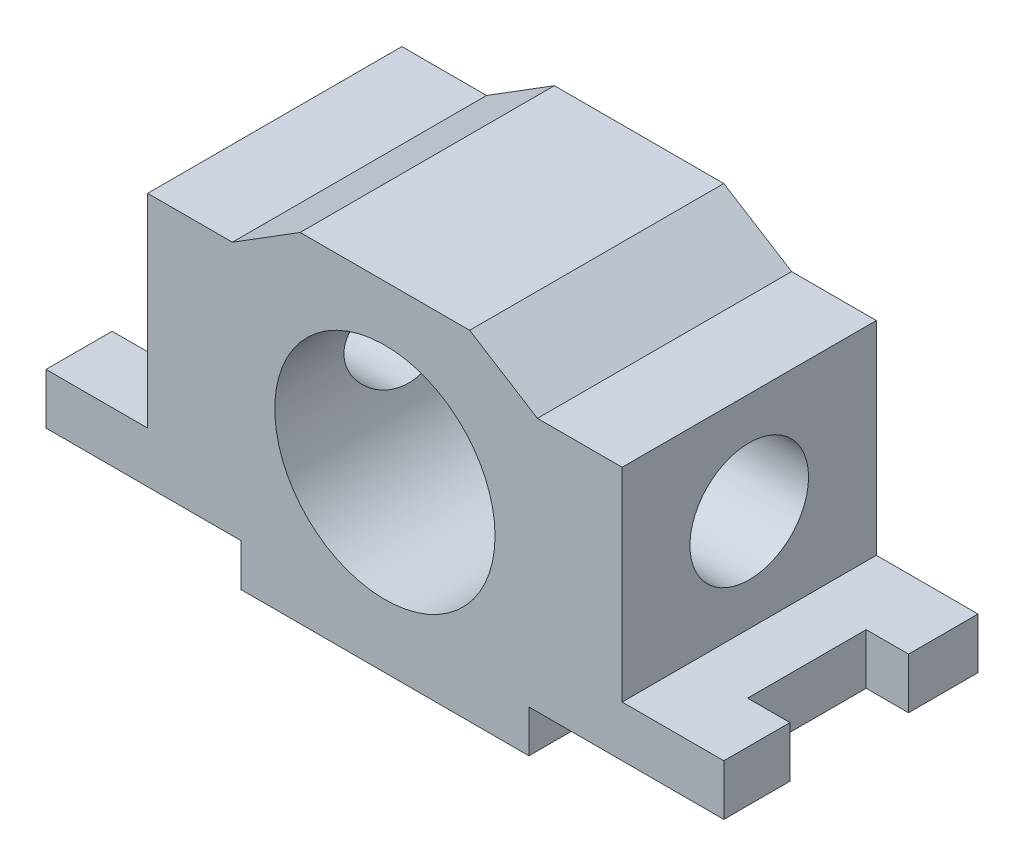
from build123d import *

# Parameters (mm, degrees)
BOSS_EXTRUDE1_DEPTH     = 15
SKETCH2_R               = 13
CUT_EXTRUDE1_DEPTH      = 30
CUT_EXTRUDE2_REACH      = 53.633
SKETCH3_W               = 5
SKETCH3_H               = 14
CUT_EXTRUDE3_DEPTH      = 78.935871074
CUT_EXTRUDE3_DEPTH_BACK = 78.935871074
SKETCH4_R               = 7


with BuildPart() as part:
    # Sketch1 → Boss-Extrude1 (new, symmetric)
    with BuildSketch(Plane.XY):
        Polygon((-40, 0), (-17, 0), (-17, -5), (17, -5), (17, 0), (40, 0), (40, 6), (28, 6), (28, 30), (18, 30), (10, 35), (-10, 35), (-18, 30), (-28, 30), (-28, 6), (-40, 6), align=None)
    extrude(amount=BOSS_EXTRUDE1_DEPTH, both=True)

    # Sketch2 → Cut-Extrude1 (cut)
    with BuildSketch(Plane.XY.offset(15)):
        with Locations((0, 15.474684959)):
            Circle(SKETCH2_R)
    extrude(amount=-CUT_EXTRUDE1_DEPTH, mode=Mode.SUBTRACT)

    # Sketch3 → Cut-Extrude2 (cut, up to next)
    with BuildSketch(Plane(origin=(0, 6, 0), x_dir=(1, 0, 0), z_dir=(0, 1, 0)), mode=Mode.PRIVATE) as cut_extrude2_sk1:
        with Locations((37.5, -0.197950113)):
            Rectangle(SKETCH3_W, SKETCH3_H)
    cut_extrude2_tool1 = extrude(cut_extrude2_sk1.sketch, amount=-CUT_EXTRUDE2_REACH, mode=Mode.PRIVATE) & part.part
    cut_extrude2 = cut_extrude2_tool1.solids().sort_by_distance((37.5, 6, 0.19795))[0]
    add(cut_extrude2, mode=Mode.SUBTRACT)

    # Mirror1: Cut-Extrude2 across plane
    add(cut_extrude2.mirror(Plane(origin=(0, 0, 0), x_dir=(0, 0, 1), z_dir=(1, 0, 0))), mode=Mode.SUBTRACT)

    # Sketch4 → Cut-Extrude3 (cut, two sides: drawn at the far end of the back side and taken through both)
    with BuildSketch(Plane(origin=(28, 0, 0), x_dir=(0, 0, -1), z_dir=(1, 0, 0)).offset(-CUT_EXTRUDE3_DEPTH_BACK)):
        with Locations(Location((0, 18, 0), (0, 0, 90))):
            Circle(SKETCH4_R)
    extrude(amount=CUT_EXTRUDE3_DEPTH + CUT_EXTRUDE3_DEPTH_BACK, mode=Mode.SUBTRACT)


solid = part.part
